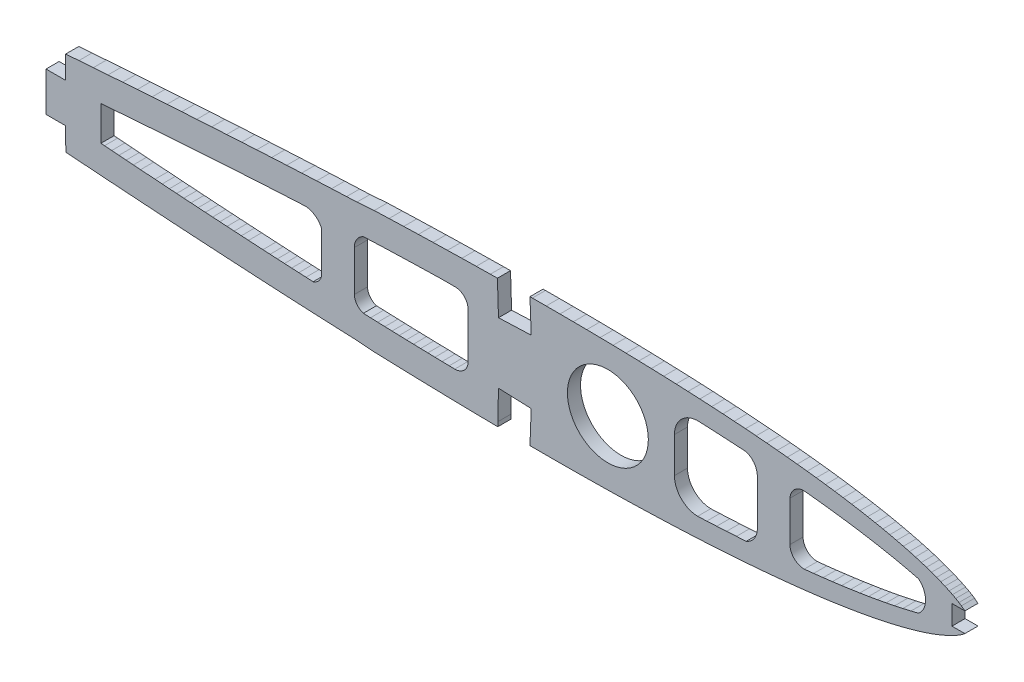
from build123d import *

# Parameters (mm, degrees)
MODEL_R         = 6.174480583
EXTRUDE_1_DEPTH = 2


with BuildPart() as part:
    # Model → 凸台-拉伸1 (new body)
    with BuildSketch(Plane.XY):
        Polygon((131.50247064, 16.187839575), (129.530516576, 16.187839575), (129.530516576, 13.187839575), (131.50247064, 13.187839575), (131.325516576, 13.041839575), (130.965516576, 12.778839575), (130.591516576, 12.534839575), (130.102516576, 12.247839575), (129.601516576, 11.982839575), (129.092516576, 11.733839575), (128.460516576, 11.443839575), (127.821516576, 11.169839575), (127.175516576, 10.910839575), (126.405516576, 10.624839575), (125.629516576, 10.356839575), (124.847516576, 10.105839575), (123.941516576, 9.833839575), (123.030516576, 9.578839575), (122.115516576, 9.337839575), (121.078516576, 9.079839575), (120.038516576, 8.837839575), (118.995516576, 8.608839575), (117.831516576, 8.368839575), (116.665516576, 8.144839575), (115.495516576, 7.932839575), (114.210516576, 7.712839575), (112.923516576, 7.506839575), (111.633516576, 7.312839575), (110.230516576, 7.115839575), (108.826516576, 6.930839575), (107.420516576, 6.756839575), (105.906516576, 6.582839575), (104.390516576, 6.420839575), (102.873516576, 6.268839575), (101.253516576, 6.118839575), (99.634516576, 5.978839575), (98.012516576, 5.848839575), (96.294516576, 5.722839575), (94.576516576, 5.606839575), (92.856516576, 5.500839575), (91.046516576, 5.399839575), (89.236516576, 5.308839575), (87.425516576, 5.227839575), (85.530516576, 5.151839575), (83.635516576, 5.084839575), (81.739516576, 5.025839575), (79.768516576, 4.974839575), (77.796516576, 4.931839575), (75.824516576, 4.896839575), (73.782516576, 4.869839575), (71.741516576, 4.850839575), (69.699516576, 4.839839575), (67.596516576, 4.836839575), (65.493516576, 4.839839575), (65.120864385, 4.841788778), (65.313864385, 9.838788778), (60.317864385, 10.031788778), (60.212478316, 5.544412812), (60.212478316, 4.881696168), (59.079516576, 4.894839575), (56.923516576, 4.927839575), (54.723516576, 4.967839575), (52.523516576, 5.014839575), (50.323516576, 5.067839575), (48.086516576, 5.127839575), (45.850516576, 5.192839575), (43.613516576, 5.264839575), (41.350516576, 5.342839575), (38.805028974, 5.544412812), (37.130558246, 5.614090744), (34.849558246, 5.713090744), (32.567558246, 5.818090744), (30.277558246, 5.929090744), (27.988558246, 6.045090744), (25.698558246, 6.166090744), (23.408558246, 6.293090744), (21.118558246, 6.424090744), (18.829558246, 6.558090744), (16.546558246, 6.693090744), (14.265558246, 6.832090744), (11.983558246, 6.974090744), (9.720558246, 7.120090744), (7.458558246, 7.271090744), (5.195558246, 7.425090744), (2.958558246, 7.580090744), (0.722558246, 7.737090744), (-1.514441754, 7.897090744), (-3.714441754, 8.059090744), (-5.720388245, 8.208624937), (-5.739497305, 11.689882058), (-8.739497305, 11.689882058), (-8.739497305, 17.689882058), (-5.739497305, 17.689882058), (-5.739497305, 21.171132058), (-3.714441754, 21.322090744), (-1.514441754, 21.483090744), (0.722558246, 21.643090744), (2.958558246, 21.801090744), (5.195558246, 21.956090744), (7.458558246, 22.110090744), (9.720558246, 22.260090744), (11.983558246, 22.406090744), (14.265558246, 22.549090744), (16.546558246, 22.687090744), (18.829558246, 22.822090744), (21.118558246, 22.956090744), (23.408558246, 23.087090744), (25.698558246, 23.214090744), (27.988558246, 23.335090744), (30.277558246, 23.451090744), (32.567558246, 23.562090744), (34.849558246, 23.667090744), (37.130558246, 23.767090744), (38.714686469, 23.833009352), (41.350516576, 24.032839575), (43.613516576, 24.110839575), (45.850516576, 24.182839575), (48.086516576, 24.248839575), (50.323516576, 24.307839575), (52.523516576, 24.360839575), (54.723516576, 24.407839575), (56.923516576, 24.447839575), (59.079516576, 24.480839575), (60.157016576, 24.493839575), (60.318549778, 19.34513398), (65.314549778, 19.53913398), (65.122556236, 24.533899222), (65.493516576, 24.535839575), (67.596516576, 24.539839575), (69.699516576, 24.535839575), (71.741516576, 24.524839575), (73.782516576, 24.505839575), (75.824516576, 24.478839575), (77.796516576, 24.444839575), (79.768516576, 24.401839575), (81.739516576, 24.349839575), (83.635516576, 24.291839575), (85.530516576, 24.224839575), (87.425516576, 24.148839575), (89.236516576, 24.066839575), (91.046516576, 23.975839575), (92.856516576, 23.874839575), (94.576516576, 23.768839575), (96.294516576, 23.653839575), (98.012516576, 23.526839575), (99.634516576, 23.397839575), (101.253516576, 23.257839575), (102.873516576, 23.106839575), (104.390516576, 22.954839575), (105.906516576, 22.792839575), (107.420516576, 22.618839575), (108.826516576, 22.445839575), (110.230516576, 22.260839575), (111.633516576, 22.062839575), (112.923516576, 21.868839575), (114.210516576, 21.662839575), (115.495516576, 21.443839575), (116.665516576, 21.231839575), (117.831516576, 21.006839575), (118.995516576, 20.767839575), (120.038516576, 20.538839575), (121.078516576, 20.295839575), (122.115516576, 20.038839575), (123.030516576, 19.797839575), (123.941516576, 19.542839575), (124.847516576, 19.270839575), (125.629516576, 19.018839575), (126.405516576, 18.751839575), (127.175516576, 18.464839575), (127.821516576, 18.206839575), (128.460516576, 17.932839575), (129.092516576, 17.642839575), (129.601516576, 17.393839575), (130.102516576, 17.128839575), (130.591516576, 16.841839575), (130.965516576, 16.596839575), align=None)
        with Locations((77.01241892, 14.687839575)):
            Circle(MODEL_R, mode=Mode.SUBTRACT)
        with BuildLine():
            Line((124.437808359, 12.349614726), (123.263768727, 12.056104818))
            Line((123.263768727, 12.056104818), (122.025156283, 11.769963332))
            Line((122.025156283, 11.769963332), (120.773860998, 11.499957587))
            Line((120.773860998, 11.499957587), (119.475898327, 11.240365053))
            Line((119.475898327, 11.240365053), (118.161780064, 10.994735471))
            Line((118.161780064, 10.994735471), (116.816694251, 10.758935366))
            Line((116.816694251, 10.758935366), (115.467812998, 10.539588415))
            Line((115.467812998, 10.539588415), (114.084833992, 10.330797862))
            Line((114.084833992, 10.330797862), (112.69262577, 10.133395204))
            Line((112.69262577, 10.133395204), (111.280669713, 9.946243444))
            Line((111.280669713, 9.946243444), (109.865080325, 9.771376519))
            Line((109.865080325, 9.771376519), (108.426942932, 9.606241557))
            Line((108.426942932, 9.606241557), (106.983150042, 9.45094988))
            ThreePointArc((106.983150042, 9.45094988), (105.445452509, 10.077614196), (104.802933569, 11.608754713))
            Line((104.802933569, 11.608754713), (104.802933569, 17.735985134))
            ThreePointArc((104.802933569, 17.735985134), (105.474763854, 19.205745994), (106.983150042, 19.785680493))
            Line((106.983150042, 19.785680493), (108.426942932, 19.630388816))
            Line((108.426942932, 19.630388816), (109.865080325, 19.465253854))
            Line((109.865080325, 19.465253854), (111.280669713, 19.290386929))
            Line((111.280669713, 19.290386929), (112.69262577, 19.103235169))
            Line((112.69262577, 19.103235169), (114.084833992, 18.905832511))
            Line((114.084833992, 18.905832511), (115.467812998, 18.697041958))
            Line((115.467812998, 18.697041958), (116.816694251, 18.477695007))
            Line((116.816694251, 18.477695007), (118.161780064, 18.241894902))
            Line((118.161780064, 18.241894902), (119.475898327, 17.99626532))
            Line((119.475898327, 17.99626532), (120.773860998, 17.736672786))
            Line((120.773860998, 17.736672786), (122.025156283, 17.466667041))
            Line((122.025156283, 17.466667041), (123.263768727, 17.180525555))
            Line((123.263768727, 17.180525555), (124.437808359, 16.887015647))
            ThreePointArc((124.437808359, 16.887015647), (125.496866882, 14.618315186), (124.437808359, 12.349614726))
        make_face(mode=Mode.SUBTRACT)
        with BuildLine():
            Line((98.13510478, 8.705594542), (96.634624102, 8.61035952))
            Line((96.634624102, 8.61035952), (95.126822193, 8.521165605))
            Line((95.126822193, 8.521165605), (93.619025665, 8.438575626))
            Line((93.619025665, 8.438575626), (92.104549006, 8.364232452))
            Line((92.104549006, 8.364232452), (90.711264861, 8.29992703))
            ThreePointArc((90.711264861, 8.29992703), (88.204247427, 9.377274392), (87.171098451, 11.902827191))
            Line((87.171098451, 11.902827191), (87.171098451, 17.333803182))
            ThreePointArc((87.171098451, 17.333803182), (88.204247427, 19.859355981), (90.711264861, 20.936703343))
            Line((90.711264861, 20.936703343), (92.104549006, 20.872397921))
            Line((92.104549006, 20.872397921), (93.619025665, 20.798054747))
            Line((93.619025665, 20.798054747), (95.126822193, 20.715464768))
            Line((95.126822193, 20.715464768), (96.634624102, 20.626270853))
            Line((96.634624102, 20.626270853), (98.13510478, 20.531035831))
            ThreePointArc((98.13510478, 20.531035831), (99.32705465, 19.66660608), (99.819997131, 18.279165631))
            Line((99.819997131, 18.279165631), (99.819997131, 11.066806301))
            ThreePointArc((99.819997131, 11.066806301), (99.319726059, 9.642034174), (98.13510478, 8.705594542))
        make_face(mode=Mode.SUBTRACT)
        with BuildLine():
            Line((-0.357289682, 12.064028476), (0.194562651, 12.020840039))
            Line((0.194562651, 12.020840039), (1.291996341, 11.936056373))
            Line((1.291996341, 11.936056373), (2.39102076, 11.852343958))
            Line((2.39102076, 11.852343958), (3.49382076, 11.769543958))
            Line((3.49382076, 11.769543958), (4.594732506, 11.685687786))
            Line((4.594732506, 11.685687786), (5.691866831, 11.604507009))
            Line((5.691866831, 11.604507009), (6.792777818, 11.524244728))
            Line((6.792777818, 11.524244728), (7.893824351, 11.443972565))
            Line((7.893824351, 11.443972565), (8.991645161, 11.365044271))
            Line((8.991645161, 11.365044271), (10.092419399, 11.287187552))
            Line((10.092419399, 11.287187552), (11.190502331, 11.209436592))
            Line((11.190502331, 11.209436592), (12.28831704, 11.134096367))
            Line((12.28831704, 11.134096367), (13.389094194, 11.058635048))
            Line((13.389094194, 11.058635048), (14.487037273, 10.98448203))
            Line((14.487037273, 10.98448203), (15.584849751, 10.911533706))
            Line((15.584849751, 10.911533706), (16.682783305, 10.839773343))
            Line((16.682783305, 10.839773343), (17.779394188, 10.769217136))
            Line((17.779394188, 10.769217136), (18.877082364, 10.699864288))
            Line((18.877082364, 10.699864288), (19.976787146, 10.631581965))
            Line((19.976787146, 10.631581965), (21.073513774, 10.563410307))
            Line((21.073513774, 10.563410307), (22.169419693, 10.497751455))
            Line((22.169419693, 10.497751455), (23.268035033, 10.43305655))
            Line((23.268035033, 10.43305655), (24.364637525, 10.368480176))
            Line((24.364637525, 10.368480176), (25.459340195, 10.306403253))
            Line((25.459340195, 10.306403253), (26.555941043, 10.245414547))
            Line((26.555941043, 10.245414547), (27.652541208, 10.185621735))
            Line((27.652541208, 10.185621735), (28.747240125, 10.127126373))
            Line((28.747240125, 10.127126373), (29.84383875, 10.070921209))
            Line((29.84383875, 10.070921209), (30.939334073, 10.014711302))
            Line((30.939334073, 10.014711302), (32.033932265, 9.960996014))
            ThreePointArc((32.033932265, 9.960996014), (32.88545244, 10.506784423), (33.322968707, 11.418678666))
            Line((33.322968707, 11.418678666), (33.322968707, 17.62101626))
            ThreePointArc((33.322968707, 17.62101626), (32.377951296, 18.830361201), (30.939334073, 19.365107477))
            Line((30.939334073, 19.365107477), (29.84383875, 19.30889757))
            Line((29.84383875, 19.30889757), (28.747240125, 19.252692406))
            Line((28.747240125, 19.252692406), (27.652541208, 19.194197044))
            Line((27.652541208, 19.194197044), (26.555941043, 19.134404232))
            Line((26.555941043, 19.134404232), (25.459340195, 19.073415526))
            Line((25.459340195, 19.073415526), (24.364637525, 19.011338603))
            Line((24.364637525, 19.011338603), (23.268035033, 18.946762229))
            Line((23.268035033, 18.946762229), (22.169419693, 18.882067324))
            Line((22.169419693, 18.882067324), (21.073513774, 18.816408472))
            Line((21.073513774, 18.816408472), (19.976787146, 18.748236814))
            Line((19.976787146, 18.748236814), (18.877082364, 18.679954491))
            Line((18.877082364, 18.679954491), (17.779394188, 18.610601643))
            Line((17.779394188, 18.610601643), (16.682783305, 18.540045436))
            Line((16.682783305, 18.540045436), (15.584849751, 18.468285073))
            Line((15.584849751, 18.468285073), (14.487037273, 18.395336749))
            Line((14.487037273, 18.395336749), (13.389094194, 18.321183731))
            Line((13.389094194, 18.321183731), (12.28831704, 18.245722412))
            Line((12.28831704, 18.245722412), (11.190502331, 18.170382187))
            Line((11.190502331, 18.170382187), (10.092419399, 18.092631227))
            Line((10.092419399, 18.092631227), (8.991645161, 18.014774508))
            Line((8.991645161, 18.014774508), (7.893824351, 17.935846214))
            Line((7.893824351, 17.935846214), (6.792777818, 17.855574051))
            Line((6.792777818, 17.855574051), (5.691866831, 17.77531177))
            Line((5.691866831, 17.77531177), (4.594732506, 17.694130993))
            Line((4.594732506, 17.694130993), (3.49382076, 17.610274821))
            Line((3.49382076, 17.610274821), (2.39102076, 17.527474821))
            Line((2.39102076, 17.527474821), (1.291996341, 17.443762406))
            Line((1.291996341, 17.443762406), (0.194562651, 17.35897874))
            Line((0.194562651, 17.35897874), (-0.357289682, 17.334181678))
            Line((-0.357289682, 17.334181678), (-0.357289682, 12.064028476))
        make_face(mode=Mode.SUBTRACT)
        with BuildLine():
            Line((39.698605906, 9.622808618), (40.790887246, 9.581027365))
            Line((40.790887246, 9.581027365), (41.884361169, 9.540439905))
            Line((41.884361169, 9.540439905), (42.976705048, 9.502237714))
            Line((42.976705048, 9.502237714), (44.068977001, 9.465231779))
            Line((44.068977001, 9.465231779), (45.161248134, 9.43061335))
            Line((45.161248134, 9.43061335), (46.255428365, 9.397130239))
            Line((46.255428365, 9.397130239), (47.345837761, 9.364954224))
            Line((47.345837761, 9.364954224), (48.435043916, 9.336353625))
            Line((48.435043916, 9.336353625), (49.528064325, 9.308848735))
            Line((49.528064325, 9.308848735), (50.617925189, 9.282587027))
            Line((50.617925189, 9.282587027), (51.707063677, 9.258754675))
            Line((51.707063677, 9.258754675), (52.795043037, 9.237304918))
            Line((52.795043037, 9.237304918), (53.646344834, 9.222386157))
            ThreePointArc((53.646344834, 9.222386157), (55.083157657, 9.795529463), (55.681388741, 11.222079114))
            Line((55.681388741, 11.222079114), (55.681388741, 18.121050144))
            ThreePointArc((55.681388741, 18.121050144), (55.095602303, 19.535263707), (53.681388741, 20.121050144))
            Line((53.681388741, 20.121050144), (51.706425731, 20.121050144))
            Line((51.706425731, 20.121050144), (50.617925189, 20.097231752))
            Line((50.617925189, 20.097231752), (49.528064325, 20.070970044))
            Line((49.528064325, 20.070970044), (48.435043916, 20.043465154))
            Line((48.435043916, 20.043465154), (47.345837761, 20.014864555))
            Line((47.345837761, 20.014864555), (46.255428365, 19.98268854))
            Line((46.255428365, 19.98268854), (45.161248134, 19.949205429))
            Line((45.161248134, 19.949205429), (44.068977001, 19.914587))
            Line((44.068977001, 19.914587), (42.976705048, 19.877581065))
            Line((42.976705048, 19.877581065), (41.884361169, 19.839378874))
            Line((41.884361169, 19.839378874), (40.790887246, 19.798791414))
            Line((40.790887246, 19.798791414), (39.698605906, 19.757010161))
            ThreePointArc((39.698605906, 19.757010161), (38.693644927, 18.893959041), (38.318092259, 17.62361893))
            Line((38.318092259, 17.62361893), (38.318092259, 11.418678666))
            ThreePointArc((38.318092259, 11.418678666), (38.721265438, 10.300057914), (39.698605906, 9.622808618))
        make_face(mode=Mode.SUBTRACT)
    extrude(amount=EXTRUDE_1_DEPTH)


solid = part.part
